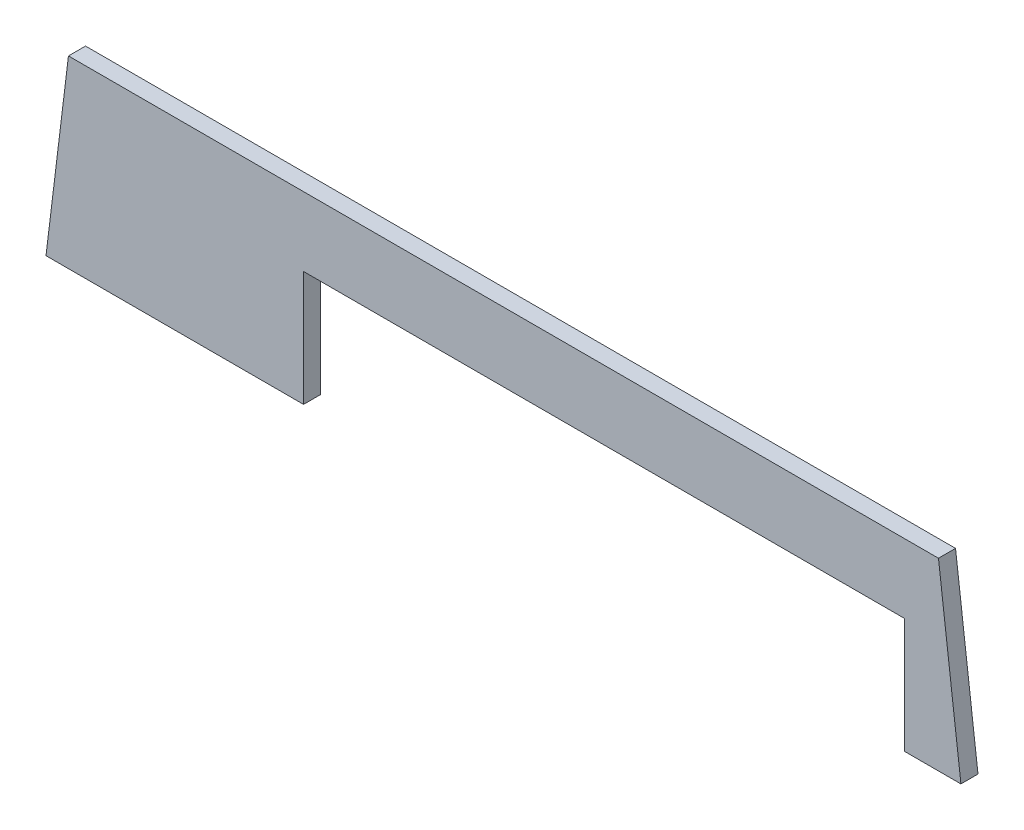
from build123d import *

# Parameters (mm, degrees)
BOSS_EXTRUDE1_DEPTH = 10


with BuildPart() as part:
    # Model → Boss-Extrude1 (new body)
    with BuildSketch(Plane.XY):
        Polygon((558.183752245, 135.859280427), (48.913918258, 135.859280427), (35.769704369, 28.004314436), (186.528835252, 28.004314436), (186.528835252, 95.396897884), (538.316172773, 95.396897884), (538.316172773, 28.004314436), (571.327966134, 28.004314436), align=None)
    extrude(amount=BOSS_EXTRUDE1_DEPTH)


solid = part.part
